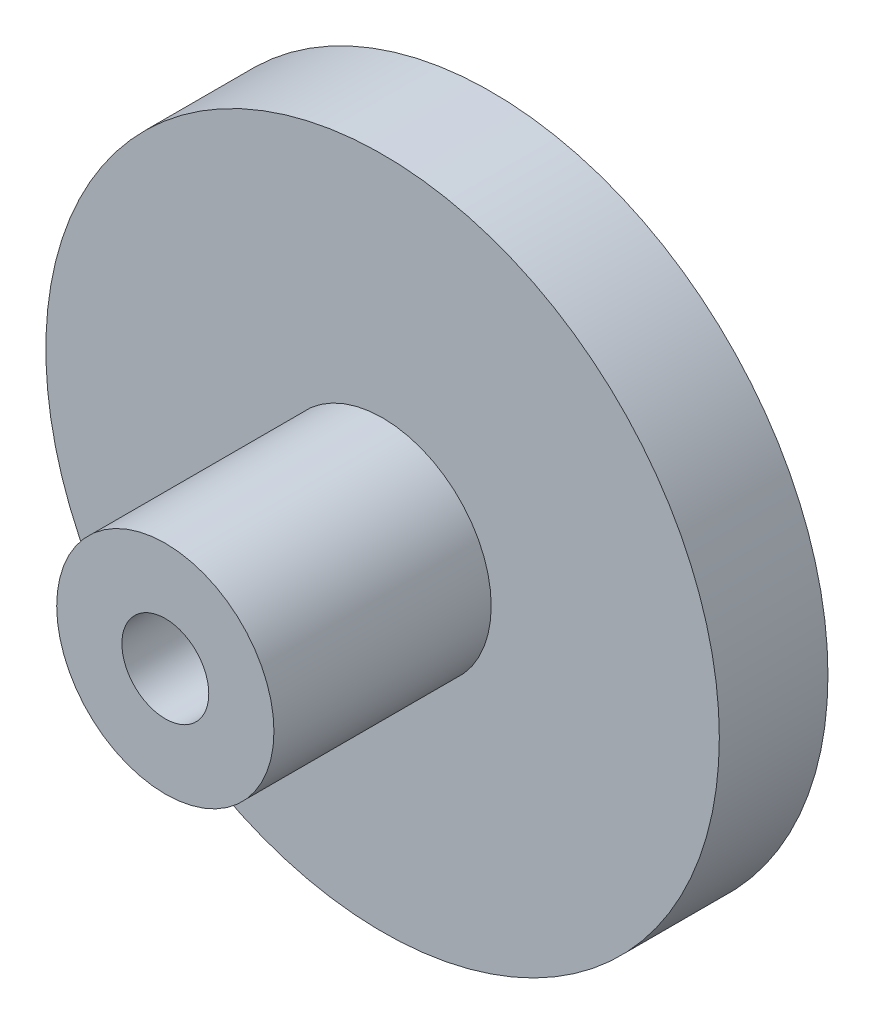
from build123d import *

# Parameters (mm, degrees)
SKETCH1_R           = 15.5
BOSS_EXTRUDE1_DEPTH = 5
SKETCH2_R           = 5
BOSS_EXTRUDE3_DEPTH = 10
SKETCH3_R           = 2
CUT_EXTRUDE1_DEPTH  = 3


with BuildPart() as part:
    # Sketch1 → Boss-Extrude1 (new body)
    with BuildSketch(Plane.XY):
        Circle(SKETCH1_R)
    extrude(amount=BOSS_EXTRUDE1_DEPTH)

    # Sketch2 → Boss-Extrude3 (add)
    with BuildSketch(Plane.XY.offset(5)):
        Circle(SKETCH2_R)
    extrude(amount=BOSS_EXTRUDE3_DEPTH)

    # Sketch3 → Cut-Extrude1 (cut)
    with BuildSketch(Plane.XY.offset(15)):
        Circle(SKETCH3_R)
    extrude(amount=-CUT_EXTRUDE1_DEPTH, mode=Mode.SUBTRACT)


solid = part.part
